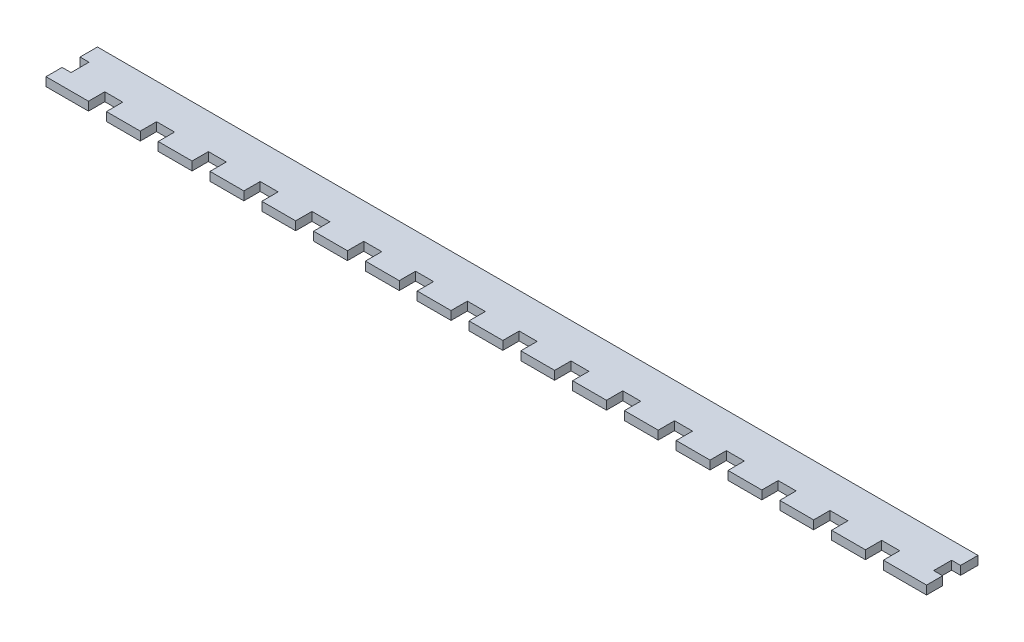
from build123d import *

# Parameters (mm, degrees)
SKETCH1_W           = 647.7
SKETCH1_H           = 57.15
BOSS_EXTRUDE1_DEPTH = 6.35
SKETCH3_W           = 24.892
SKETCH3_H           = 12
BOSS_EXTRUDE2_DEPTH = 6.35
SKETCH4_W           = 13.208
SKETCH4_H           = 13.208
CUT_EXTRUDE2_DEPTH  = 327.443679101
SKETCH5_W           = 647.7
SKETCH5_H           = 6.35
CUT_EXTRUDE3_DEPTH  = 31.304


with BuildPart() as part:
    # Sketch1 → Boss-Extrude1 (new body)
    with BuildSketch(Plane(origin=(0, 0, 0), x_dir=(1, 0, 0), z_dir=(0, 1, 0))):
        Rectangle(SKETCH1_W, SKETCH1_H)
    extrude(amount=BOSS_EXTRUDE1_DEPTH)

    # Sketch3 → Boss-Extrude2 (add)
    with BuildSketch(Plane(origin=(0, 0, 0), x_dir=(1, 0, 0), z_dir=(0, 1, 0))):
        Polygon((-317.5, -40.575), (-292.608, -40.575), (-292.608, -28.575), (-317.5, -28.575), (-323.85, -28.575), (-323.85, -40.575), align=None)
        with Locations((-266.954, -34.575)):
            Rectangle(SKETCH3_W, SKETCH3_H)
        with Locations((-228.854, -34.575)):
            Rectangle(SKETCH3_W, SKETCH3_H)
        with Locations((-190.754, -34.575)):
            Rectangle(SKETCH3_W, SKETCH3_H)
        with Locations((-152.654, -34.575)):
            Rectangle(SKETCH3_W, SKETCH3_H)
        with Locations((-114.554, -34.575)):
            Rectangle(SKETCH3_W, SKETCH3_H)
        with Locations((-76.454, -34.575)):
            Rectangle(SKETCH3_W, SKETCH3_H)
        with Locations((-38.354, -34.575)):
            Rectangle(SKETCH3_W, SKETCH3_H)
        with Locations((-0.254, -34.575)):
            Rectangle(SKETCH3_W, SKETCH3_H)
        with Locations((37.846, -34.575)):
            Rectangle(SKETCH3_W, SKETCH3_H)
        with Locations((75.946, -34.575)):
            Rectangle(SKETCH3_W, SKETCH3_H)
        with Locations((114.046, -34.575)):
            Rectangle(SKETCH3_W, SKETCH3_H)
        with Locations((152.146, -34.575)):
            Rectangle(SKETCH3_W, SKETCH3_H)
        with Locations((190.246, -34.575)):
            Rectangle(SKETCH3_W, SKETCH3_H)
        with Locations((228.346, -34.575)):
            Rectangle(SKETCH3_W, SKETCH3_H)
        with Locations((266.446, -34.575)):
            Rectangle(SKETCH3_W, SKETCH3_H)
        Polygon((316.992, -28.575), (292.1, -28.575), (292.1, -40.575), (316.992, -40.575), (323.85, -40.575), (323.85, -28.575), align=None)
    extrude(amount=BOSS_EXTRUDE2_DEPTH)

    # Sketch4 → Cut-Extrude2 (cut, through all)
    with BuildSketch(Plane(origin=(0, 0, 0), x_dir=(1, 0, 0), z_dir=(0, 1, 0))):
        with Locations((-323.85, 3.875)):
            Rectangle(SKETCH4_W, SKETCH4_H)
        with Locations((-323.85, -22.133)):
            Rectangle(SKETCH4_W, SKETCH4_H)
        with Locations((323.85, -22.133)):
            Rectangle(SKETCH4_W, SKETCH4_H)
        with Locations((323.85, 3.875)):
            Rectangle(SKETCH4_W, SKETCH4_H)
        with Locations((-323.85, -48.141)):
            Rectangle(SKETCH4_W, SKETCH4_H)
        with Locations((323.85, -48.141)):
            Rectangle(SKETCH4_W, SKETCH4_H)
    extrude(amount=CUT_EXTRUDE2_DEPTH, mode=Mode.SUBTRACT)

    # Sketch5 → Cut-Extrude3 (cut)
    with BuildSketch(Plane(origin=(0, 0, -28.575), x_dir=(-1, 0, 0), z_dir=(0, 0, -1))):
        with Locations((0, 3.175)):
            Rectangle(SKETCH5_W, SKETCH5_H)
    extrude(amount=-CUT_EXTRUDE3_DEPTH, mode=Mode.SUBTRACT)


solid = part.part
